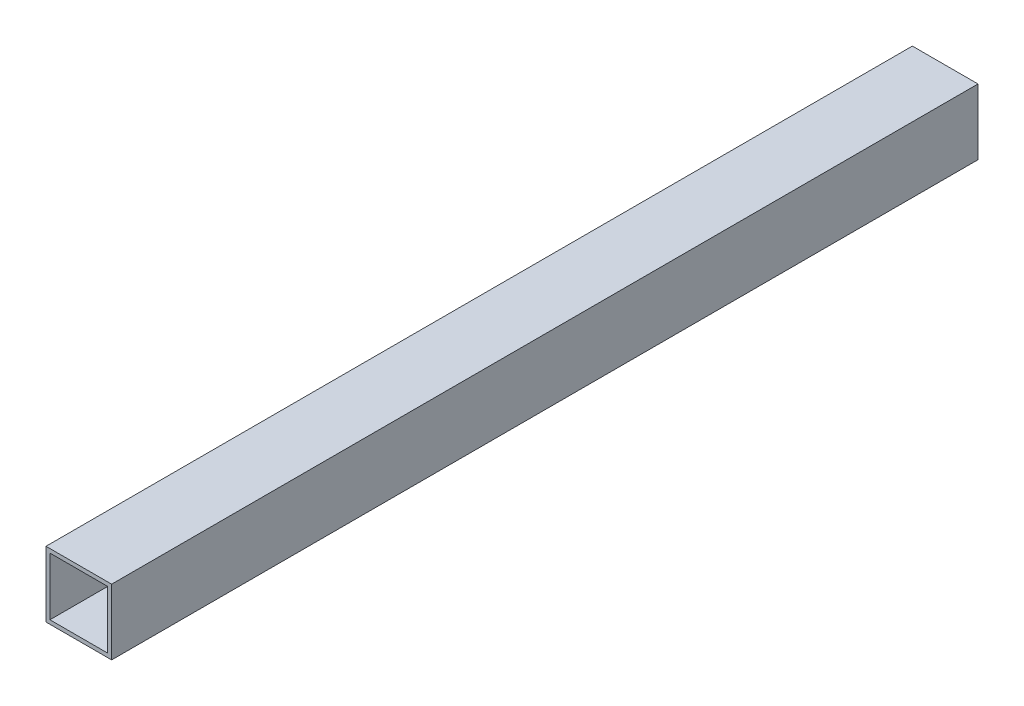
from build123d import *

# Parameters (mm, degrees)
SKETCH_1_W      = 25
SKETCH_1_H      = 25
SKETCH_1_W_2    = 22
SKETCH_1_H_2    = 22
EXTRUDE_1_DEPTH = 330


with BuildPart() as part:
    # Эскиз1 → Вытянуть-Тонкостенный1 (new body)
    with BuildSketch(Plane.XY):
        Rectangle(SKETCH_1_W, SKETCH_1_H)
        Rectangle(SKETCH_1_W_2, SKETCH_1_H_2, mode=Mode.SUBTRACT)
    extrude(amount=EXTRUDE_1_DEPTH)


solid = part.part
